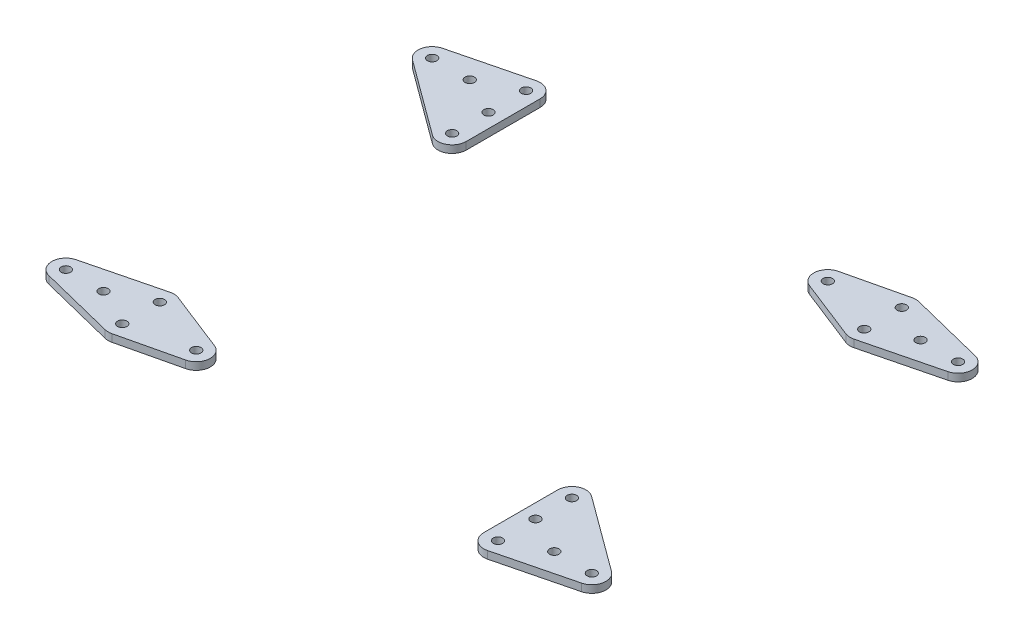
from build123d import *

# Parameters (mm, degrees)
SKETCH1_R             = 2.5
BOSS_EXTRUDE1_DEPTH   = 4
BOSS_EXTRUDE1_2_DEPTH = 4
BOSS_EXTRUDE1_3_DEPTH = 4
BOSS_EXTRUDE1_4_DEPTH = 4


with BuildPart() as part:
    # Sketch1 → Boss-Extrude1 (new body)
    with BuildSketch(Plane(origin=(0, 0, 0), x_dir=(1, 0, 0), z_dir=(0, 1, 0))):
        with BuildLine():
            Line((-141.819017188, 104.776068751), (-101.819017188, 114.776068751))
            ThreePointArc((-101.819017188, 114.776068751), (-95.384408429, 113.411540785), (-92.5, 107.5))
            Line((-92.5, 107.5), (-92.5, 68.124885321))
            ThreePointArc((-92.5, 68.124885321), (-96.612153633, 61.433659948), (-104.439332531, 62.079860368))
            Line((-104.439332531, 62.079860368), (-144.439332531, 91.454975047))
            ThreePointArc((-144.439332531, 91.454975047), (-147.358982244, 98.94754286), (-141.819017188, 104.776068751))
        make_face()
        with Locations(Location((-140, 97.5, 0), (0, 0, 270))):
            Circle(SKETCH1_R, mode=Mode.SUBTRACT)
        with Locations(Location((-120, 97.5, 0), (0, 0, 270))):
            Circle(SKETCH1_R, mode=Mode.SUBTRACT)
        with Locations(Location((-100, 107.5, 0), (0, 0, 270))):
            Circle(SKETCH1_R, mode=Mode.SUBTRACT)
        with Locations(Location((-100, 87.5, 0), (0, 0, 90))):
            Circle(SKETCH1_R, mode=Mode.SUBTRACT)
        with Locations(Location((-100, 68.124885321, 0), (0, 0, 270))):
            Circle(SKETCH1_R, mode=Mode.SUBTRACT)
    extrude(amount=BOSS_EXTRUDE1_DEPTH)


with BuildPart() as body_2:
    # Sketch1 → Boss-Extrude1 2 (new body)
    with BuildSketch(Plane(origin=(0, 0, 0), x_dir=(1, 0, 0), z_dir=(0, 1, 0))):
        with BuildLine():
            Line((-141.819017188, -90.223931249), (-101.819017188, -80.223931249))
            ThreePointArc((-101.819017188, -80.223931249), (-99.517532378, -80.015534422), (-97.261852072, -80.517697663))
            Line((-97.261852072, -80.517697663), (-65.386737393, -93.017697663))
            ThreePointArc((-65.386737393, -93.017697663), (-60.643950631, -100.534430686), (-66.407096174, -107.30063014))
            Line((-66.407096174, -107.30063014), (-98.282210853, -114.80063014))
            ThreePointArc((-98.282210853, -114.80063014), (-100.052082574, -114.999819158), (-101.819017188, -114.776068751))
            Line((-101.819017188, -114.776068751), (-141.819017188, -104.776068751))
            ThreePointArc((-141.819017188, -104.776068751), (-147.5, -97.5), (-141.819017188, -90.223931249))
        make_face()
        with Locations(Location((-68.124885321, -100, 0), (0, 0, 270))):
            Circle(SKETCH1_R, mode=Mode.SUBTRACT)
        with Locations(Location((-100, -87.5, 0), (0, 0, 270))):
            Circle(SKETCH1_R, mode=Mode.SUBTRACT)
        with Locations(Location((-100, -107.5, 0), (0, 0, 90))):
            Circle(SKETCH1_R, mode=Mode.SUBTRACT)
        with Locations(Location((-120, -97.5, 0), (0, 0, 90))):
            Circle(SKETCH1_R, mode=Mode.SUBTRACT)
        with Locations(Location((-140, -97.5, 0), (0, 0, 90))):
            Circle(SKETCH1_R, mode=Mode.SUBTRACT)
    extrude(amount=BOSS_EXTRUDE1_2_DEPTH)


with BuildPart() as body_3:
    # Sketch1 → Boss-Extrude1 3 (new body)
    with BuildSketch(Plane(origin=(0, 0, 0), x_dir=(1, 0, 0), z_dir=(0, 1, 0))):
        with BuildLine():
            Line((141.819017188, -104.776068751), (101.819017188, -114.776068751))
            ThreePointArc((101.819017188, -114.776068751), (95.384408429, -113.411540785), (92.5, -107.5))
            Line((92.5, -107.5), (92.5, -68.124885321))
            ThreePointArc((92.5, -68.124885321), (96.612153633, -61.433659948), (104.439332531, -62.079860368))
            Line((104.439332531, -62.079860368), (144.439332531, -91.454975047))
            ThreePointArc((144.439332531, -91.454975047), (147.358982244, -98.94754286), (141.819017188, -104.776068751))
        make_face()
        with Locations(Location((140, -97.5, 0), (0, 0, 270))):
            Circle(SKETCH1_R, mode=Mode.SUBTRACT)
        with Locations(Location((120, -97.5, 0), (0, 0, 270))):
            Circle(SKETCH1_R, mode=Mode.SUBTRACT)
        with Locations(Location((100, -107.5, 0), (0, 0, 270))):
            Circle(SKETCH1_R, mode=Mode.SUBTRACT)
        with Locations(Location((100, -87.5, 0), (0, 0, 90))):
            Circle(SKETCH1_R, mode=Mode.SUBTRACT)
        with Locations(Location((100, -68.124885321, 0), (0, 0, 270))):
            Circle(SKETCH1_R, mode=Mode.SUBTRACT)
    extrude(amount=BOSS_EXTRUDE1_3_DEPTH)


with BuildPart() as body_4:
    # Sketch1 → Boss-Extrude1 4 (new body)
    with BuildSketch(Plane(origin=(0, 0, 0), x_dir=(1, 0, 0), z_dir=(0, 1, 0))):
        with BuildLine():
            Line((141.819017188, 90.223931249), (101.819017188, 80.223931249))
            ThreePointArc((101.819017188, 80.223931249), (99.517532378, 80.015534422), (97.261852072, 80.517697663))
            Line((97.261852072, 80.517697663), (65.386737393, 93.017697663))
            ThreePointArc((65.386737393, 93.017697663), (60.643950631, 100.534430686), (66.407096174, 107.30063014))
            Line((66.407096174, 107.30063014), (98.282210853, 114.80063014))
            ThreePointArc((98.282210853, 114.80063014), (100.052082574, 114.999819158), (101.819017188, 114.776068751))
            Line((101.819017188, 114.776068751), (141.819017188, 104.776068751))
            ThreePointArc((141.819017188, 104.776068751), (147.5, 97.5), (141.819017188, 90.223931249))
        make_face()
        with Locations(Location((68.124885321, 100, 0), (0, 0, 270))):
            Circle(SKETCH1_R, mode=Mode.SUBTRACT)
        with Locations(Location((100, 87.5, 0), (0, 0, 270))):
            Circle(SKETCH1_R, mode=Mode.SUBTRACT)
        with Locations(Location((100, 107.5, 0), (0, 0, 90))):
            Circle(SKETCH1_R, mode=Mode.SUBTRACT)
        with Locations(Location((120, 97.5, 0), (0, 0, 90))):
            Circle(SKETCH1_R, mode=Mode.SUBTRACT)
        with Locations(Location((140, 97.5, 0), (0, 0, 90))):
            Circle(SKETCH1_R, mode=Mode.SUBTRACT)
    extrude(amount=BOSS_EXTRUDE1_4_DEPTH)


solid = Compound([part.part, body_2.part, body_3.part, body_4.part])
